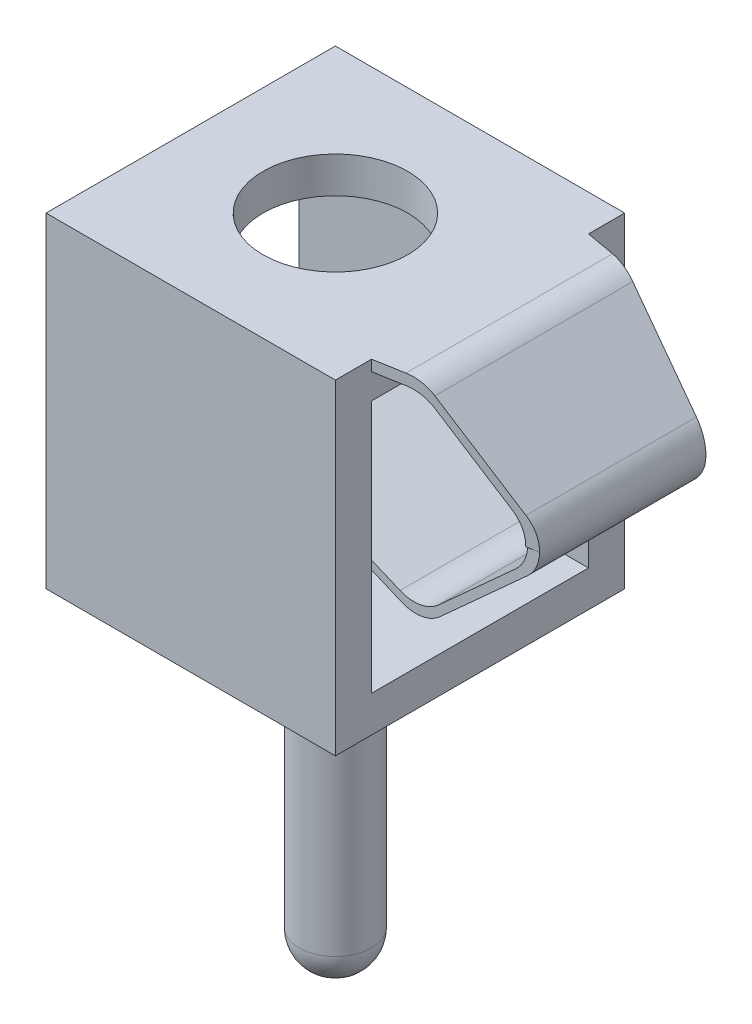
from build123d import *

# Parameters (mm, degrees)
SKETCH1_W               = 4
SKETCH1_H               = 4.5
SKETCH1_W_2             = 3
SKETCH1_H_2             = 3.5
BOSS_EXTRUDE1_DEPTH     = 4
SKETCH2_R               = 0.5
BOSS_EXTRUDE2_DEPTH     = 4.55
FILLET1_R               = 0.5
SKETCH3_R               = 1
CUT_EXTRUDE1_DEPTH      = 2.55
BOSS_EXTRUDE3_START     = -0.5
BOSS_EXTRUDE3_DEPTH     = 3
CUT_EXTRUDE2_DEPTH      = 1.5
CUT_EXTRUDE3_DEPTH      = 4.5
CUT_EXTRUDE3_DEPTH_BACK = 7.5
SKETCH7_W               = 0.349986897
SKETCH7_H               = 2


with BuildPart() as part:
    # Sketch1 → Boss-Extrude1 (new body)
    with BuildSketch(Plane(origin=(0, 0, 0), x_dir=(0, 0, -1), z_dir=(1, 0, 0))):
        Rectangle(SKETCH1_W, SKETCH1_H)
        Rectangle(SKETCH1_W_2, SKETCH1_H_2, mode=Mode.SUBTRACT)
    extrude(amount=BOSS_EXTRUDE1_DEPTH)

    # Sketch2 → Boss-Extrude2 (add)
    with BuildSketch(Plane.XZ.offset(2.25)):
        with Locations(Location((2, 0, 0), (0, 0, 90))):
            Circle(SKETCH2_R)
    extrude(amount=BOSS_EXTRUDE2_DEPTH)

    # Fillet1
    fillet1_edges = [part.edges().sort_by_distance(p)[0] for p in [
        (2, -6.8, -0.5),
    ]]
    fillet(fillet1_edges, radius=FILLET1_R)

    # Sketch3 → Cut-Extrude1 (cut)
    with BuildSketch(Plane(origin=(0, 2.25, 0), x_dir=(1, 0, 0), z_dir=(0, 1, 0))):
        with Locations(Location((2, 0, 0), (0, 0, 270))):
            Circle(SKETCH3_R)
    extrude(amount=-CUT_EXTRUDE1_DEPTH, mode=Mode.SUBTRACT)

    # Sketch5 → Boss-Extrude3 (add)
    with BuildSketch(Plane.XY.offset(2).offset(BOSS_EXTRUDE3_START)):
        with BuildLine():
            Line((4, 2.25), (4.403883865, 2.25))
            ThreePointArc((4.403883865, 2.25), (4.586458051, 2.215474668), (4.743818499, 2.116666667))
            Line((4.743818499, 2.116666667), (5.813186883, 1.125261165))
            ThreePointArc((5.813186883, 1.125261165), (5.973243782, 0.755684806), (5.808896382, 0.387996313))
            Line((5.808896382, 0.387996313), (4.596439486, -0.710104164))
            ThreePointArc((4.596439486, -0.710104164), (4.344752484, -0.832406779), (4.066768671, -0.800324431))
            Line((4.066768671, -0.800324431), (1.595431684, 0.240227029))
            Line((1.595431684, 0.240227029), (1.595431684, 0.359579889))
            Line((1.595431684, 0.359579889), (4.04486832, -0.671750473))
            ThreePointArc((4.04486832, -0.671750473), (4.322852132, -0.703832821), (4.574539135, -0.581530206))
            Line((4.574539135, -0.581530206), (5.646078544, 0.388943829))
            ThreePointArc((5.646078544, 0.388943829), (5.810425944, 0.756632322), (5.650369044, 1.126208681))
            Line((5.650369044, 1.126208681), (4.743818499, 1.966666667))
            ThreePointArc((4.743818499, 1.966666667), (4.586458051, 2.065474668), (4.403883865, 2.1))
            Line((4.403883865, 2.1), (4, 2.1))
            Line((4, 2.1), (4, 2.25))
        make_face()
    extrude(amount=-BOSS_EXTRUDE3_DEPTH)

    # Sketch6 → Cut-Extrude2 (cut)
    with BuildSketch(Plane(origin=(0, 2.25, 0), x_dir=(1, 0, 0), z_dir=(0, 1, 0))):
        Polygon((4, 1.5), (5.973252249, 1.15), (5.973252249, 1.5), align=None)
        Polygon((4, -1.5), (5.973252249, -1.15), (5.973252249, -1.5), align=None)
    extrude(amount=-CUT_EXTRUDE2_DEPTH, mode=Mode.SUBTRACT)

    # Sketch7 → Cut-Extrude3 (cut, two sides: drawn at the far end of the back side and taken through both)
    with BuildSketch(Plane(origin=(4, 0, 0), x_dir=(0, 0, -1), z_dir=(1, 0, 0)).offset(-CUT_EXTRUDE3_DEPTH_BACK)):
        with Locations((-1.325006552, -0.25)):
            Rectangle(SKETCH7_W, SKETCH7_H)
        with Locations((1.325006552, -0.25)):
            Rectangle(SKETCH7_W, SKETCH7_H)
    extrude(amount=CUT_EXTRUDE3_DEPTH + CUT_EXTRUDE3_DEPTH_BACK, mode=Mode.SUBTRACT)


solid = part.part
